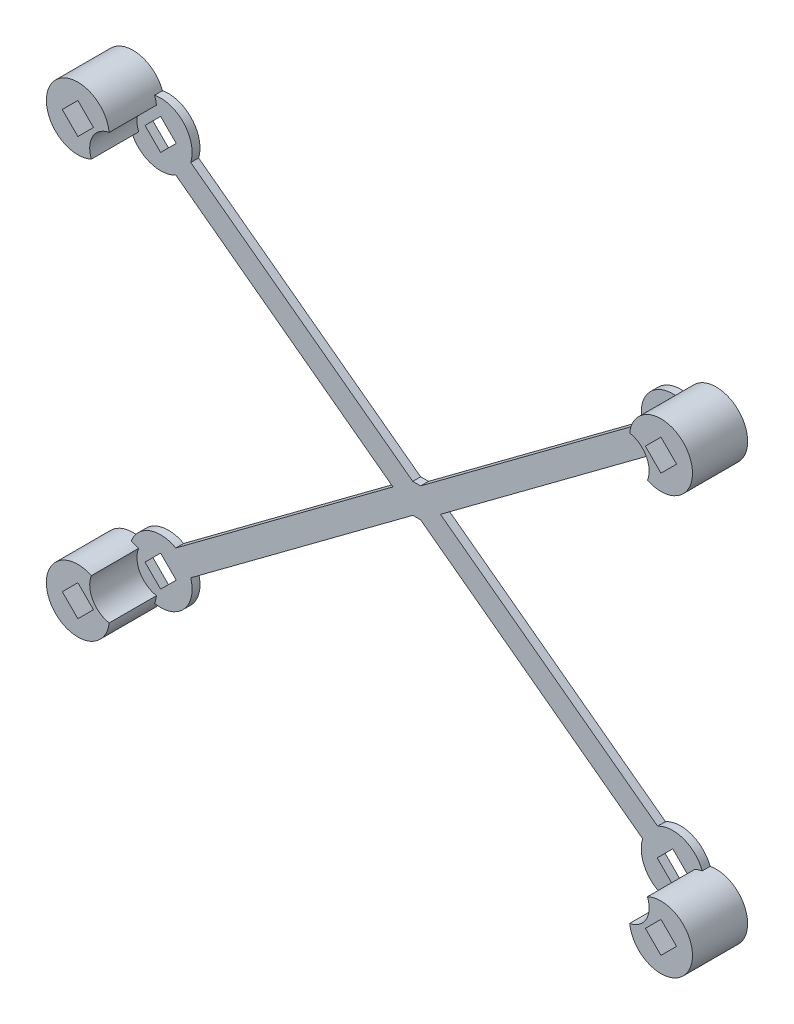
from build123d import *

# Parameters (mm, degrees)
RESSALTO_EXTRUS_O1_DEPTH = 1
RESSALTO_EXTRUS_O3_DEPTH = 6


with BuildPart() as part:
    # Esboço1 → Ressalto-extrusão1 (new body)
    with BuildSketch(Plane.XY):
        with BuildLine():
            Line((0, 1.869246597), (-27.993590125, 22.6849931))
            Line((-27.993590125, 22.6849931), (-28.177477369, 22.821729769))
            ThreePointArc((-28.177477369, 22.821729769), (-29.024277982, 26.673027959), (-32.763028277, 27.926549102))
            ThreePointArc((-32.763028277, 27.926549102), (-39.996629104, 28.442571725), (-35.736971723, 22.573450898))
            ThreePointArc((-35.736971723, 22.573450898), (-33.37897048, 20.245211003), (-30.074575689, 20.493899428))
            Line((-30.074575689, 20.493899428), (-29.783698424, 20.277606077))
            Line((-29.783698424, 20.277606077), (-2.513814389, 0))
            Line((-2.513814389, 0), (-29.783698424, -20.277606077))
            Line((-29.783698424, -20.277606077), (-30.074575689, -20.493899428))
            ThreePointArc((-30.074575689, -20.493899428), (-33.37897048, -20.245211003), (-35.736971723, -22.573450898))
            ThreePointArc((-35.736971723, -22.573450898), (-39.996629104, -28.442571725), (-32.763028277, -27.926549102))
            ThreePointArc((-32.763028277, -27.926549102), (-29.024277982, -26.673027959), (-28.177477369, -22.821729769))
            Line((-28.177477369, -22.821729769), (-27.993590125, -22.6849931))
            Line((-27.993590125, -22.6849931), (0, -1.869246597))
            Line((0, -1.869246597), (1, -1.869246597))
            Line((1, -1.869246597), (28.993590125, -22.6849931))
            Line((28.993590125, -22.6849931), (29.177477369, -22.821729769))
            ThreePointArc((29.177477369, -22.821729769), (30.024277982, -26.673027959), (33.763028277, -27.926549102))
            ThreePointArc((33.763028277, -27.926549102), (40.996629104, -28.442571725), (36.736971723, -22.573450898))
            ThreePointArc((36.736971723, -22.573450898), (34.37897048, -20.245211003), (31.074575689, -20.493899428))
            Line((31.074575689, -20.493899428), (30.783698424, -20.277606077))
            Line((30.783698424, -20.277606077), (3.513814389, 0))
            Line((3.513814389, 0), (30.783698424, 20.277606077))
            Line((30.783698424, 20.277606077), (31.074575689, 20.493899428))
            ThreePointArc((31.074575689, 20.493899428), (34.37897048, 20.245211003), (36.736971723, 22.573450898))
            ThreePointArc((36.736971723, 22.573450898), (40.996629104, 28.442571725), (33.763028277, 27.926549102))
            ThreePointArc((33.763028277, 27.926549102), (30.024277982, 26.673027959), (29.177477369, 22.821729769))
            Line((29.177477369, 22.821729769), (28.993590125, 22.6849931))
            Line((28.993590125, 22.6849931), (1, 1.869246597))
            Line((1, 1.869246597), (0, 1.869246597))
        make_face()
        Polygon((-38.479898987, 26.5), (-36.5, 28.479898987), (-34.520101013, 26.5), (-36.5, 24.520101013), align=None, mode=Mode.SUBTRACT)
        Polygon((-33.979898987, 24), (-32, 25.979898987), (-30.020101013, 24), (-32, 22.020101013), align=None, mode=Mode.SUBTRACT)
        Polygon((-36.5, -28.479898987), (-34.520101013, -26.5), (-36.5, -24.520101013), (-38.479898987, -26.5), align=None, mode=Mode.SUBTRACT)
        Polygon((-32, -25.979898987), (-30.020101013, -24), (-32, -22.020101013), (-33.979898987, -24), align=None, mode=Mode.SUBTRACT)
        Polygon((39.479898987, -26.5), (37.5, -28.479898987), (35.520101013, -26.5), (37.5, -24.520101013), align=None, mode=Mode.SUBTRACT)
        Polygon((34.979898987, -24), (33, -25.979898987), (31.020101013, -24), (33, -22.020101013), align=None, mode=Mode.SUBTRACT)
        Polygon((37.5, 28.479898987), (35.520101013, 26.5), (37.5, 24.520101013), (39.479898987, 26.5), align=None, mode=Mode.SUBTRACT)
        Polygon((33, 25.979898987), (31.020101013, 24), (33, 22.020101013), (34.979898987, 24), align=None, mode=Mode.SUBTRACT)
    extrude(amount=RESSALTO_EXTRUS_O1_DEPTH)

    # Esboço3 → Ressalto-extrusão3 (add)
    # profile 1 of 4: a face of its own
    with BuildSketch(Plane.XY.offset(1)):
        with BuildLine():
            ThreePointArc((-32.525798154, 26.953563323), (-39.996629104, 28.442571725), (-34.785522601, 22.886059319))
            ThreePointArc((-34.785522601, 22.886059319), (-34.622471828, 25.456928794), (-32.525798154, 26.953563323))
        make_face()
        Polygon((-38.479898987, 26.5), (-36.5, 24.520101013), (-34.520101013, 26.5), (-36.5, 28.479898987), align=None, mode=Mode.SUBTRACT)
    # profile 2 of 4: a face of its own
    with BuildSketch(Plane.XY.offset(1)):
        with BuildLine():
            ThreePointArc((-32.525798154, -26.953563323), (-34.622471828, -25.456928794), (-34.785522601, -22.886059319))
            ThreePointArc((-34.785522601, -22.886059319), (-39.996629104, -28.442571725), (-32.525798154, -26.953563323))
        make_face()
        Polygon((-36.5, -24.520101013), (-34.520101013, -26.5), (-36.5, -28.479898987), (-38.479898987, -26.5), align=None, mode=Mode.SUBTRACT)
    # profile 3 of 4: a face of its own
    with BuildSketch(Plane.XY.offset(1)):
        with BuildLine():
            ThreePointArc((33.525798154, -26.953563323), (40.996629104, -28.442571725), (35.785522601, -22.886059319))
            ThreePointArc((35.785522601, -22.886059319), (35.622471828, -25.456928794), (33.525798154, -26.953563323))
        make_face()
        Polygon((39.479898987, -26.5), (37.5, -24.520101013), (35.520101013, -26.5), (37.5, -28.479898987), align=None, mode=Mode.SUBTRACT)
    # profile 4 of 4: a face of its own
    with BuildSketch(Plane.XY.offset(1)):
        with BuildLine():
            ThreePointArc((33.525798154, 26.953563323), (35.622471828, 25.456928794), (35.785522601, 22.886059319))
            ThreePointArc((35.785522601, 22.886059319), (40.996629104, 28.442571725), (33.525798154, 26.953563323))
        make_face()
        Polygon((37.5, 24.520101013), (35.520101013, 26.5), (37.5, 28.479898987), (39.479898987, 26.5), align=None, mode=Mode.SUBTRACT)
    extrude(amount=RESSALTO_EXTRUS_O3_DEPTH)


solid = part.part
